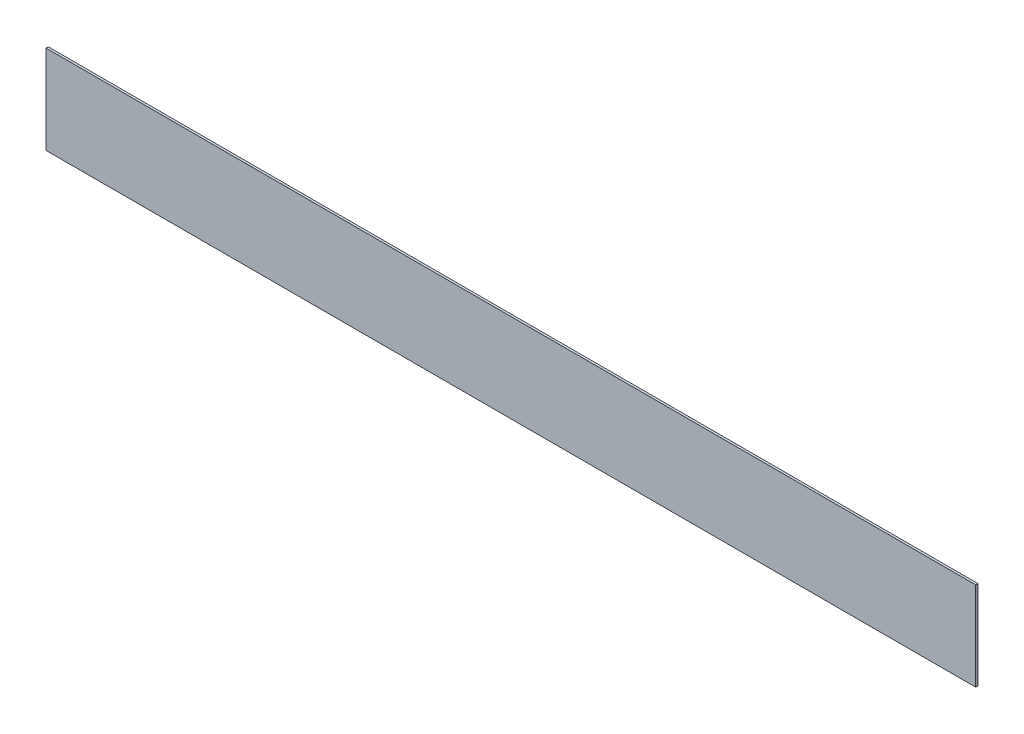
from build123d import *

# Parameters (mm, degrees)
SKETCH_1_W      = 2056
SKETCH_1_H      = 196
EXTRUDE_1_DEPTH = 5


with BuildPart() as part:
    # 草图1 → 凸台-拉伸1 (new body)
    with BuildSketch(Plane.XY):
        with Locations((1028, 98)):
            Rectangle(SKETCH_1_W, SKETCH_1_H)
    extrude(amount=EXTRUDE_1_DEPTH)


solid = part.part
